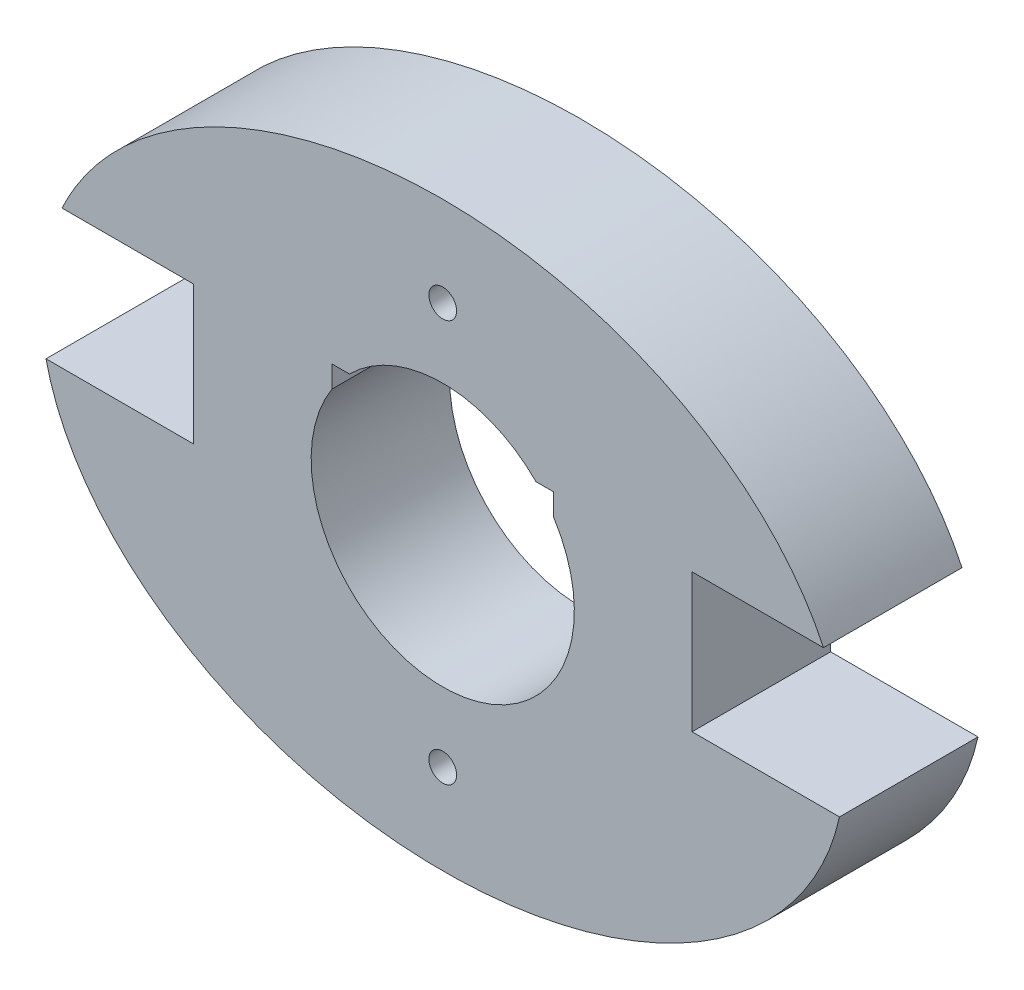
from build123d import *

# Parameters (mm, degrees)
ESQUISSE1_R             = 0.5
ESQUISSE1_R_2           = 4.75
BOSS_EXTRU_1_DEPTH      = 5
ESQUISSE2_W             = 8
ESQUISSE2_H             = 5
ENL_V_MAT_EXTRU_1_DEPTH = 5


with BuildPart() as part:
    # Esquisse1 → Boss.-Extru.1 (new body)
    with BuildSketch(Plane.XY):
        with BuildLine():
            Line((-13.742210946, 3.35), (-9, 3.35))
            Line((-9, 3.35), (-9, -1.65))
            Line((-9, -1.65), (-14.319850287, -1.65))
            add(Edge.make_bspline(
                [(-14.319850287, -1.65), (-12.37517926, -10.5), (0, -10.5), (12.37517926, -10.5), (14.319850287, -1.65)],
                knots=[3.299389549, 3.299389549, 3.299389549, 4.71238898, 4.71238898, 6.125388411, 6.125388411, 6.125388411], degree=2, weights=[1, 0.760638829, 1, 0.760638829, 1]))
            Line((14.319850287, -1.65), (9, -1.65))
            Line((9, -1.65), (9, 3.35))
            Line((9, 3.35), (13.742210946, 3.35))
            add(Edge.make_bspline(
                [(13.742210946, 3.35), (0, 32.910447761), (-13.742210946, 3.35)],
                knots=[0.324724419, 0.324724419, 0.324724419, 2.816868235, 2.816868235, 2.816868235], degree=2, weights=[1, 0.319047619, 1]))
        make_face()
        with Locations((0, 7.2545)):
            Circle(ESQUISSE1_R, mode=Mode.SUBTRACT)
        with Locations((0, -7.2545)):
            Circle(ESQUISSE1_R, mode=Mode.SUBTRACT)
        Circle(ESQUISSE1_R_2, mode=Mode.SUBTRACT)
    extrude(amount=BOSS_EXTRU_1_DEPTH)

    # Esquisse2 → Enlèv. mat.-Extru.1 (cut)
    with BuildSketch(Plane(origin=(0, 0, 0), x_dir=(-1, 0, 0), z_dir=(0, 0, -1))):
        with Locations((0, 0.85)):
            Rectangle(ESQUISSE2_W, ESQUISSE2_H)
    extrude(amount=-ENL_V_MAT_EXTRU_1_DEPTH, mode=Mode.SUBTRACT)


solid = part.part
